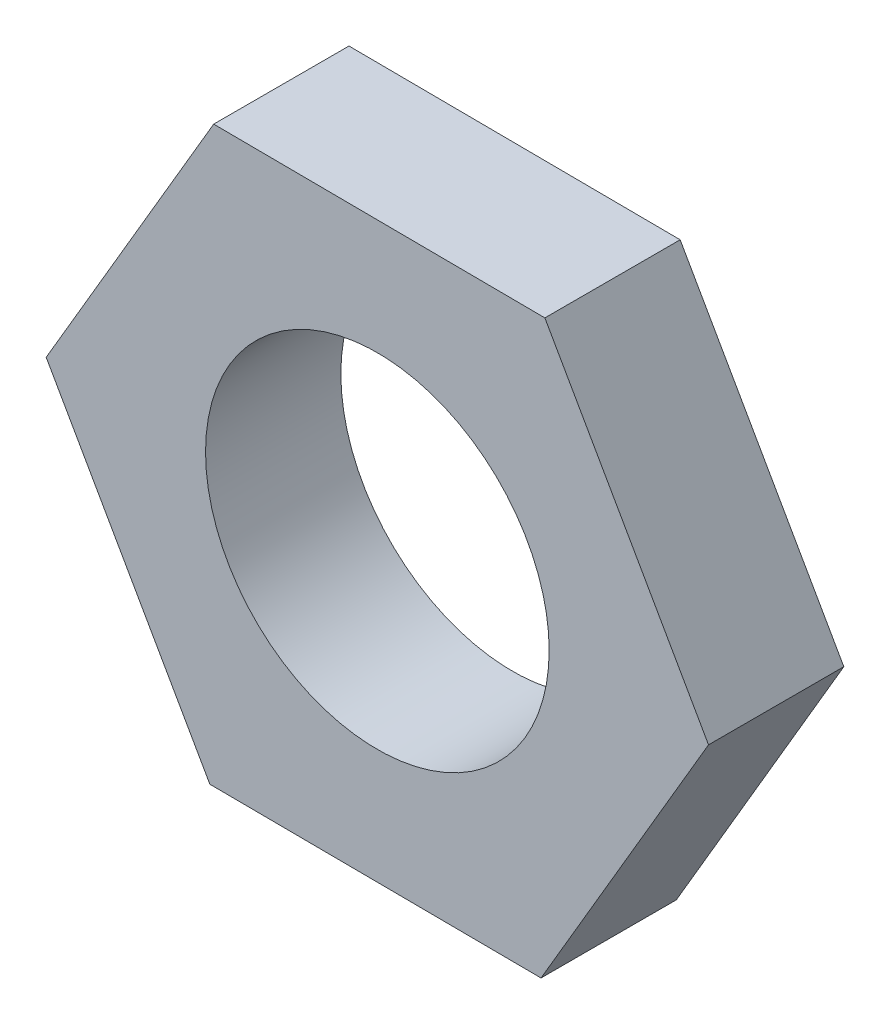
from build123d import *

# Parameters (mm, degrees)
SKETCH1_R           = 3.175
BOSS_EXTRUDE1_DEPTH = 2.5


with BuildPart() as part:
    # Sketch1 → Boss-Extrude1 (new body)
    with BuildSketch(Plane.XY):
        Polygon((3.02425668, -5.320451566), (6.119774556, -0.041142671), (3.095517876, 5.279308895), (-3.02425668, 5.320451566), (-6.119774556, 0.041142671), (-3.095517876, -5.279308895), align=None)
        Circle(SKETCH1_R, mode=Mode.SUBTRACT)
    extrude(amount=BOSS_EXTRUDE1_DEPTH)


solid = part.part
